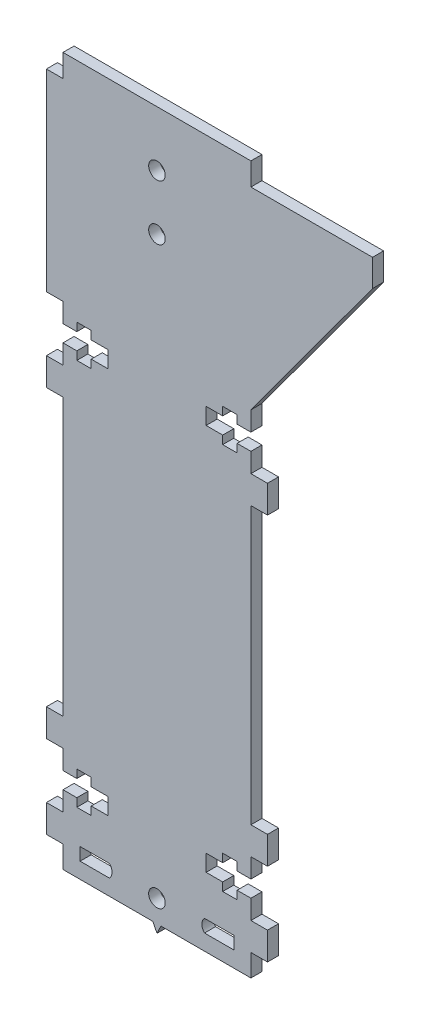
from build123d import *

# Parameters (mm, degrees)
SKETCH_1_R      = 1.5
EXTRUDE_1_DEPTH = 2


with BuildPart() as part:
    # 草图1 → 凸台-拉伸1 (new body)
    with BuildSketch(Plane.XY):
        Polygon((16.993865071, -34), (16.993865071, -84), (19.993865071, -84), (19.993865071, -89), (16.993865071, -89), (16.993865071, -92.5), (14.493865071, -92.5), (14.493865071, -91), (11.893865071, -91), (11.893865071, -92.5), (8.893865071, -92.5), (8.893865071, -95.5), (11.893865071, -95.5), (11.893865071, -97), (14.493865071, -97), (14.493865071, -95.5), (16.993865071, -95.5), (16.993865071, -99), (19.993865071, -99), (19.993865071, -104), (16.993865071, -104), (16.993865071, -108), (0.721190694, -108), (0, -109.5), (-0.721190694, -108), (-16.993865071, -108), (-16.993865071, -104), (-19.993865071, -104), (-19.993865071, -99), (-16.993865071, -99), (-16.993865071, -95.5), (-14.493865071, -95.5), (-14.493865071, -97), (-11.893865071, -97), (-11.893865071, -95.5), (-8.893865071, -95.5), (-8.893865071, -92.5), (-11.893865071, -92.5), (-11.893865071, -91), (-14.493865071, -91), (-14.493865071, -92.5), (-16.993865071, -92.5), (-16.993865071, -89), (-19.993865071, -89), (-19.993865071, -84), (-16.993865071, -84), (-16.993865071, -34), (-19.993865071, -34), (-19.993865071, -29), (-16.993865071, -29), (-16.993865071, -25.5), (-14.493865071, -25.5), (-14.493865071, -27), (-11.893865071, -27), (-11.893865071, -25.5), (-8.893865071, -25.5), (-8.893865071, -22.5), (-11.893865071, -22.5), (-11.893865071, -21), (-14.493865071, -21), (-14.493865071, -22.5), (-16.993865071, -22.5), (-16.993865071, -19), (-19.993865071, -19), (-19.993865071, 15.9), (-16.993865071, 15.9), (-16.993865071, 20), (16.993865071, 20), (16.993865071, 15.9), (38.993865071, 15.9), (38.993865071, 11), (16.993865071, -19), (16.993865071, -22.5), (14.493865071, -22.5), (14.493865071, -21), (11.893865071, -21), (11.893865071, -22.5), (8.893865071, -22.5), (8.893865071, -25.5), (11.893865071, -25.5), (11.893865071, -27), (14.493865071, -27), (14.493865071, -25.5), (16.993865071, -25.5), (16.993865071, -29), (19.993865071, -29), (19.993865071, -34), align=None)
        with Locations((0, -104)):
            Circle(SKETCH_1_R, mode=Mode.SUBTRACT)
        Circle(SKETCH_1_R, mode=Mode.SUBTRACT)
        with Locations((0, 10)):
            Circle(SKETCH_1_R, mode=Mode.SUBTRACT)
        with BuildLine():
            Line((13.9, -105.15), (8.6, -105.15))
            ThreePointArc((8.6, -105.15), (8.123654403, -104), (8.6, -102.85))
            Line((8.6, -102.85), (13.9, -102.85))
            Line((13.9, -102.85), (13.9, -105.15))
        make_face(mode=Mode.SUBTRACT)
        with BuildLine():
            Line((-13.9, -102.85), (-8.6, -102.85))
            ThreePointArc((-8.6, -102.85), (-8.123654403, -104), (-8.6, -105.15))
            Line((-8.6, -105.15), (-13.9, -105.15))
            Line((-13.9, -105.15), (-13.9, -102.85))
        make_face(mode=Mode.SUBTRACT)
    extrude(amount=EXTRUDE_1_DEPTH)


solid = part.part
